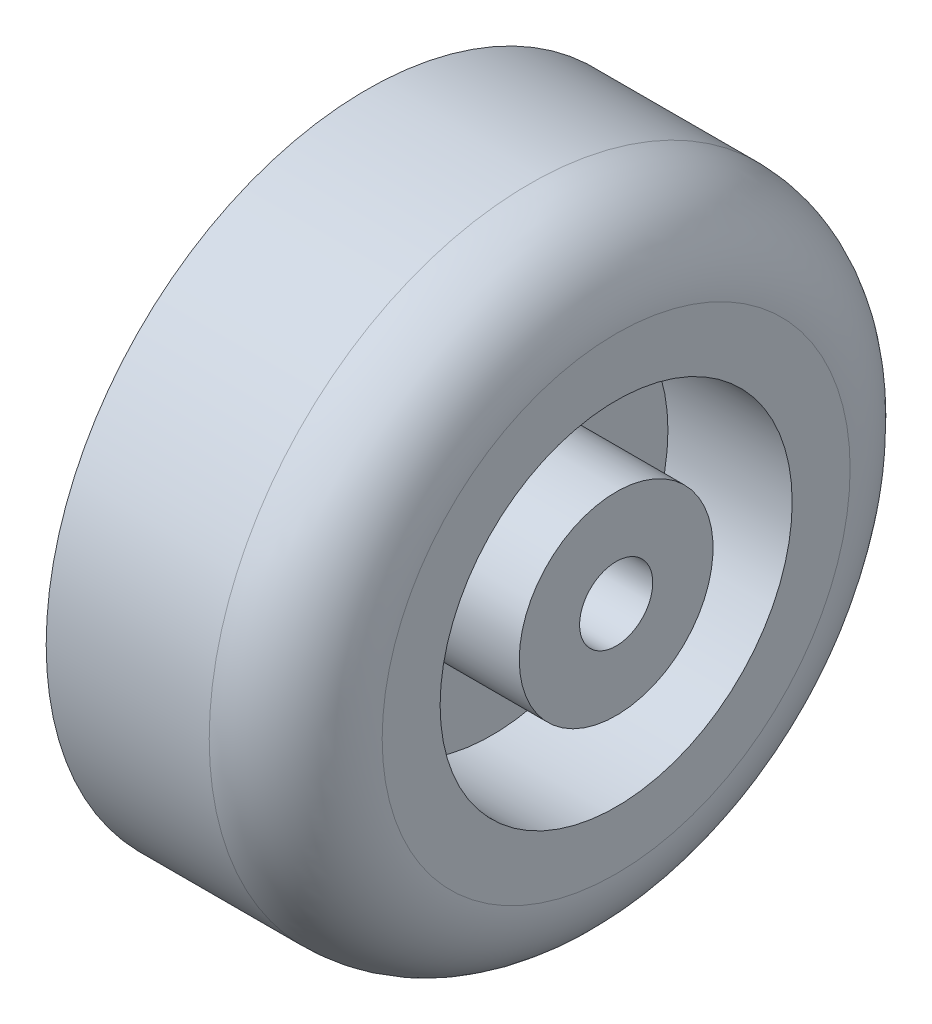
from build123d import *

# Parameters (mm, degrees)
FILLET1_R = 90


with BuildPart() as part:
    # Sketch1 → Revolve1 (revolve)
    with BuildSketch(Plane.XY, mode=Mode.PRIVATE) as revolve1_sk:
        Polygon((0, 333.491187989), (259.658864609, 333.491187989), (259.658864609, 183.190027572), (130.366818781, 183.190027572), (130.366818781, 100.842554238), (259.658864609, 100.842554238), (259.658864609, 38.075888385), (0, 38.075888385), align=None)
    revolve(revolve1_sk.sketch.rotate(Axis((0, 0, 0), (1, 0, 0)), 90), axis=Axis((0, 0, 0), (1, 0, 0)))

    # Fillet1
    fillet1_edges = [part.edges().sort_by_distance(p)[0] for p in [
        (259.658864609, 0, -333.491187989),
    ]]
    fillet(fillet1_edges, radius=FILLET1_R)


solid = part.part
